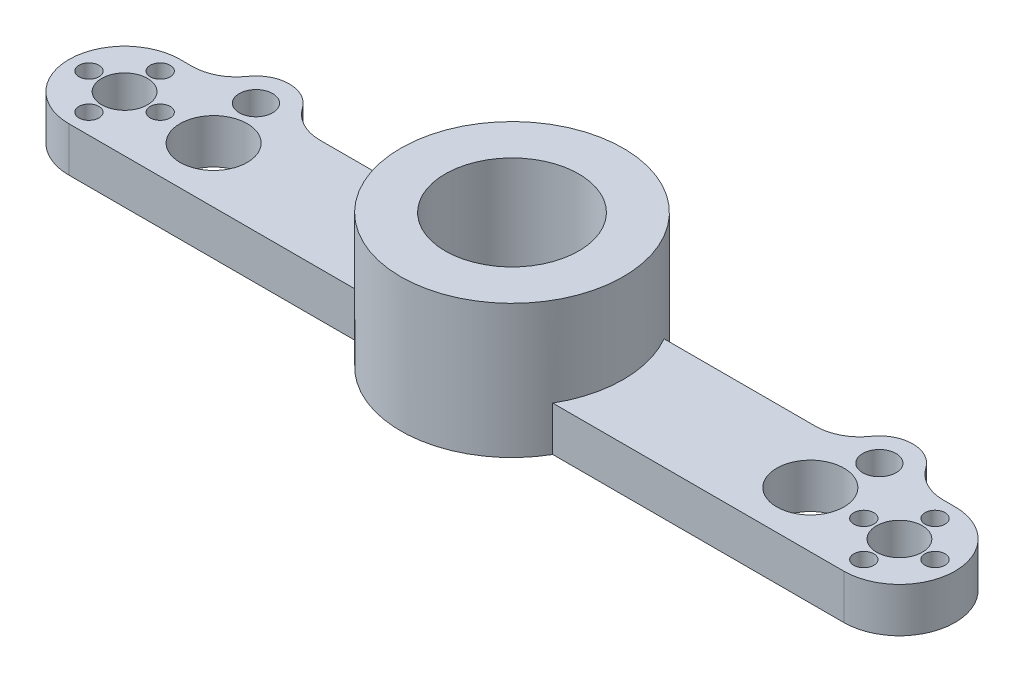
from build123d import *

# Parameters (mm, degrees)
ESQUISSE1_R                                        = 5.15
ESQUISSE1_R_2                                      = 15
BOSS_EXTRU_1_DEPTH                                 = 10
DIAM_TRE_DU_PER_AGE_4_5_4_5_1_D                    = 4.5
R_P_TITION_CIRCULAIRE1_COUNT                       = 4
ESQUISSE4_R                                        = 7.55
ENL_V_MAT_EXTRU_1_DEPTH                            = 104.078853311
SYM_TRIE1_COPY_1_D                                 = 4.5
SYM_TRIE1_COPY_2_D                                 = 4.5
SYM_TRIE1_COPY_3_D                                 = 4.5
ESQUISSE7_R                                        = 25
ESQUISSE7_R_2                                      = 15
BOSS_EXTRU_3_DEPTH                                 = 20
BOSS_EXTRU_4_DEPTH                                 = 10
CHAMBRAGE_POUR_VIS_T_TE_RONDE_BOMB_E_M_D           = 3.4
CHAMBRAGE_POUR_VIS_T_TE_RONDE_BOMB_E_M_CBORE_D     = 7.5
CHAMBRAGE_POUR_VIS_T_TE_RONDE_BOMB_E_M_CBORE_DEPTH = 6.4
CONG_1_R                                           = 10


with BuildPart() as part:
    # Esquisse1 → Boss.-Extru.1 (new body)
    with BuildSketch(Plane(origin=(0, 0, 0), x_dir=(1, 0, 0), z_dir=(0, 1, 0))):
        with BuildLine():
            Line((87, -12.5), (21.650635095, -12.5))
            ThreePointArc((21.650635095, -12.5), (0, -25), (-21.650635095, -12.5))
            Line((-21.650635095, -12.5), (-87, -12.5))
            ThreePointArc((-87, -12.5), (-99.5, 0), (-87, 12.5))
            Line((-87, 12.5), (-21.650635095, 12.5))
            ThreePointArc((-21.650635095, 12.5), (0, 25), (21.650635095, 12.5))
            Line((21.650635095, 12.5), (87, 12.5))
            ThreePointArc((87, 12.5), (99.5, 0), (87, -12.5))
        make_face()
        with Locations(Location((-87, 0, 0), (0, 0, 270))):
            Circle(ESQUISSE1_R, mode=Mode.SUBTRACT)
        with Locations(Location((87, 0, 0), (0, 0, 270))):
            Circle(ESQUISSE1_R, mode=Mode.SUBTRACT)
        with Locations(Location((0, 0, 0), (0, 0, 270))):
            Circle(ESQUISSE1_R_2, mode=Mode.SUBTRACT)
    extrude(amount=BOSS_EXTRU_1_DEPTH)

    # Diamètre du perçage Ø4.5 (4.5)1 (through all)
    with Locations(Plane(origin=(0, 10, 0), x_dir=(1, 0, 0), z_dir=(0, 1, 0))):
        with Locations((-87, 8)):
            diam_tre_du_per_age_4_5_4_5_1 = Hole(DIAM_TRE_DU_PER_AGE_4_5_4_5_1_D / 2)

    # Répétition circulaire1: Diamètre du perçage Ø4.5 (4.5)1 ×4 about axis
    r_p_tition_circulaire1_axis = Axis((-87, 0, 0), (0, 1, 0))
    for i in range(1, R_P_TITION_CIRCULAIRE1_COUNT):
        add(diam_tre_du_per_age_4_5_4_5_1.rotate(r_p_tition_circulaire1_axis, i * 360 / R_P_TITION_CIRCULAIRE1_COUNT), mode=Mode.SUBTRACT)

    # Esquisse4 → Enlèv. mat.-Extru.1 (cut, through all)
    with BuildSketch(Plane(origin=(0, 10, 0), x_dir=(1, 0, 0), z_dir=(0, 1, 0))):
        with Locations(Location((-67, 0, 0), (0, 0, 270))):
            Circle(ESQUISSE4_R)
    enl_v_mat_extru_1 = extrude(amount=-ENL_V_MAT_EXTRU_1_DEPTH, mode=Mode.SUBTRACT)

    # Symétrie1: Diamètre du perçage Ø4.5 (4.5)1, Enlèv. mat.-Extru.1 across plane
    add(diam_tre_du_per_age_4_5_4_5_1.mirror(Plane(origin=(0, 0, 0), x_dir=(0, 0, 1), z_dir=(1, 0, 0))), mode=Mode.SUBTRACT)
    add(enl_v_mat_extru_1.mirror(Plane(origin=(0, 0, 0), x_dir=(0, 0, 1), z_dir=(1, 0, 0))), mode=Mode.SUBTRACT)

    # Symétrie1 copy 1 (through all)
    with Locations(Plane(origin=(87, 10, -87), x_dir=(0, 0, -1), z_dir=(0, 1, 0))):
        with Locations((-87, -8)):
            Hole(SYM_TRIE1_COPY_1_D / 2)

    # Symétrie1 copy 2 (through all)
    with Locations(Plane(origin=(174, 10, 0), x_dir=(1, 0, 0), z_dir=(0, 1, 0))):
        with Locations((-87, -8)):
            Hole(SYM_TRIE1_COPY_2_D / 2)

    # Symétrie1 copy 3 (through all)
    with Locations(Plane(origin=(87, 10, 87), x_dir=(0, 0, 1), z_dir=(0, 1, 0))):
        with Locations((-87, -8)):
            Hole(SYM_TRIE1_COPY_3_D / 2)

    # Esquisse7 → Boss.-Extru.3 (add)
    with BuildSketch(Plane(origin=(0, 10, 0), x_dir=(1, 0, 0), z_dir=(0, 1, 0))):
        with Locations(Location((0, 0, 0), (0, 0, 30))):
            Circle(ESQUISSE7_R)
        with Locations(Location((0, 0, 0), (0, 0, 270))):
            Circle(ESQUISSE7_R_2, mode=Mode.SUBTRACT)
    extrude(amount=BOSS_EXTRU_3_DEPTH)

    # Esquisse8 → Boss.-Extru.4 (add, through all)
    with BuildSketch(Plane(origin=(0, 10, 0), x_dir=(1, 0, 0), z_dir=(0, 1, 0))):
        with BuildLine():
            Line((62.5, 12.5), (77.5, 12.5))
            ThreePointArc((77.5, 12.5), (70, 20), (62.5, 12.5))
        make_face()
        with BuildLine():
            Line((-62.5, 12.5), (-77.5, 12.5))
            ThreePointArc((-77.5, 12.5), (-70, 20), (-62.5, 12.5))
        make_face()
    extrude(amount=-BOSS_EXTRU_4_DEPTH)

    # Chambrage pour vis à tête ronde bombée M31 (through all)
    with Locations(Plane(origin=(0, 10, 0), x_dir=(1, 0, 0), z_dir=(0, 1, 0))):
        with Locations((70, 12.5), (-70, 12.5)):
            CounterBoreHole(CHAMBRAGE_POUR_VIS_T_TE_RONDE_BOMB_E_M_D / 2, CHAMBRAGE_POUR_VIS_T_TE_RONDE_BOMB_E_M_CBORE_D / 2, CHAMBRAGE_POUR_VIS_T_TE_RONDE_BOMB_E_M_CBORE_DEPTH)

    # Congé1
    cong_1_edges = [part.edges().sort_by_distance(p)[0] for p in [
        (62.5, 5, -12.5),
        (77.5, 5, -12.5),
        (-77.5, 5, -12.5),
        (-62.5, 5, -12.5),
    ]]
    fillet(cong_1_edges, radius=CONG_1_R)


solid = part.part
